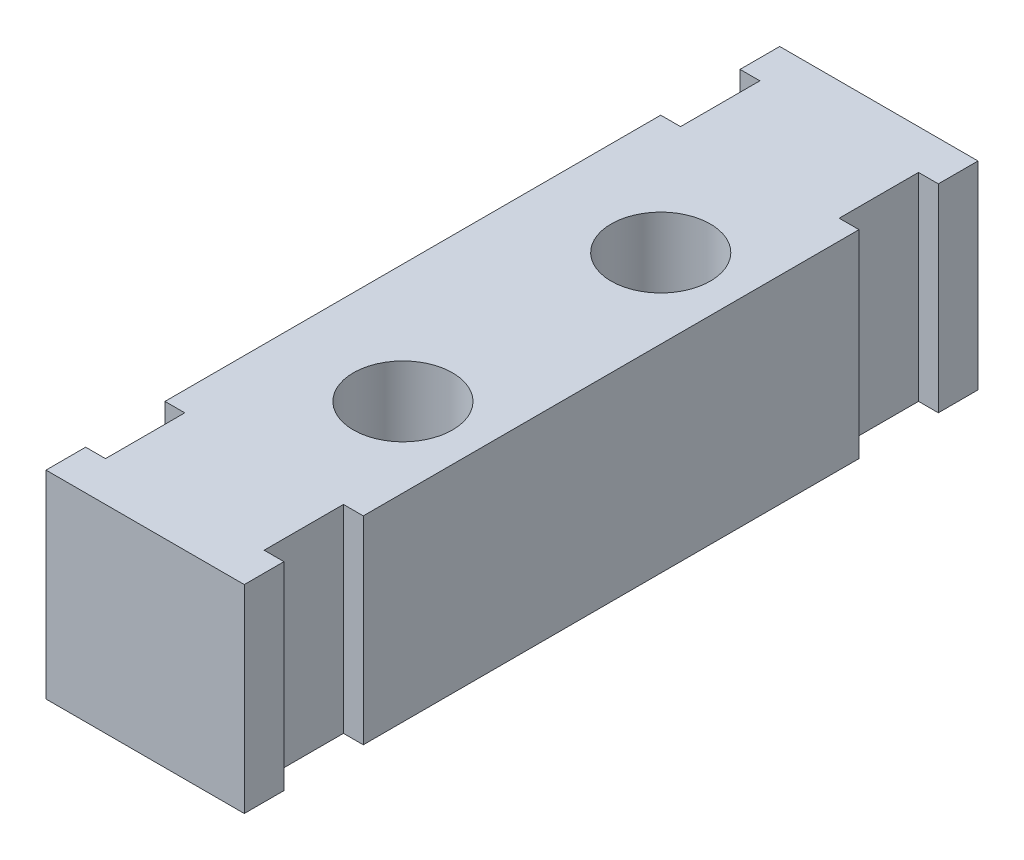
from build123d import *

# Parameters (mm, degrees)
CROQUIS1_W              = 10
CROQUIS1_H              = 10
SALIENTE_EXTRUIR1_DEPTH = 37
CROQUIS2_R              = 2.5
CORTAR_EXTRUIR1_DEPTH   = 39.65229618
CROQUIS4_W              = 1
CROQUIS4_H              = 4
CORTAR_EXTRUIR2_DEPTH   = 39.65229618


with BuildPart() as part:
    # Croquis1 → Saliente-Extruir1 (new body)
    with BuildSketch(Plane.XY):
        Rectangle(CROQUIS1_W, CROQUIS1_H)
    extrude(amount=SALIENTE_EXTRUIR1_DEPTH)

    # Croquis2 → Cortar-Extruir1 (cut, through all)
    with BuildSketch(Plane(origin=(0, 5, 0), x_dir=(1, 0, 0), z_dir=(0, 1, 0))):
        with Locations(Location((1, -12, 0), (0, 0, 270))):
            Circle(CROQUIS2_R)
        with Locations(Location((1, -25, 0), (0, 0, 270))):
            Circle(CROQUIS2_R)
    extrude(amount=-CORTAR_EXTRUIR1_DEPTH, mode=Mode.SUBTRACT)

    # Croquis4 → Cortar-Extruir2 (cut, through all)
    with BuildSketch(Plane(origin=(0, 5, 0), x_dir=(1, 0, 0), z_dir=(0, 1, 0))):
        with Locations((-4.5, -33)):
            Rectangle(CROQUIS4_W, CROQUIS4_H)
        with Locations((4.5, -33)):
            Rectangle(CROQUIS4_W, CROQUIS4_H)
        with Locations((4.5, -4)):
            Rectangle(CROQUIS4_W, CROQUIS4_H)
        with Locations((-4.5, -4)):
            Rectangle(CROQUIS4_W, CROQUIS4_H)
    extrude(amount=-CORTAR_EXTRUIR2_DEPTH, mode=Mode.SUBTRACT)


solid = part.part
